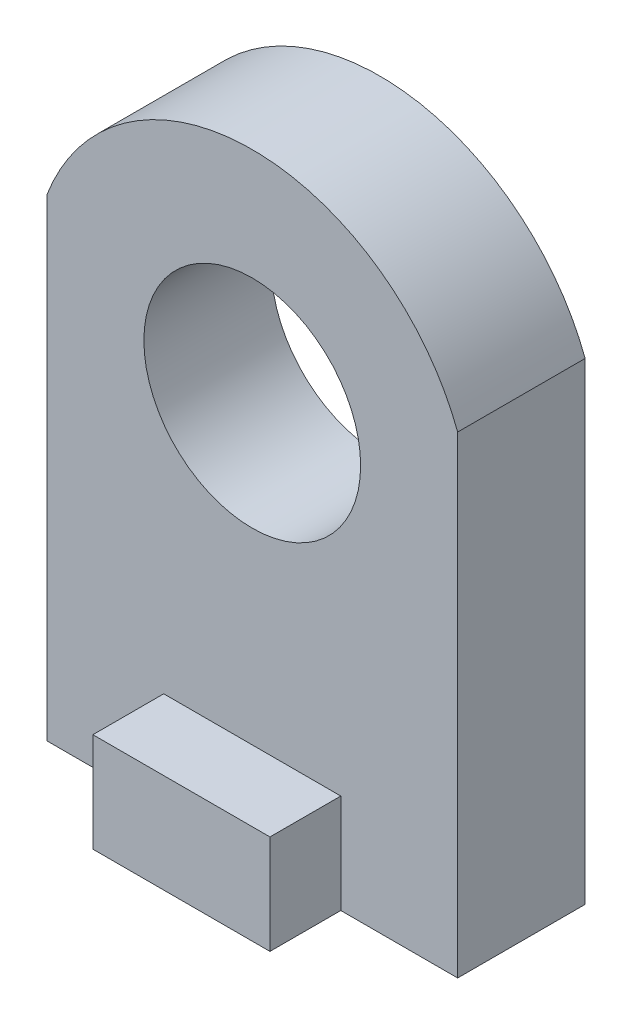
from build123d import *

# Parameters (mm, degrees)
SKETCH1_R           = 7.65
BOSS_EXTRUDE1_DEPTH = 9
SKETCH2_W           = 12.5
SKETCH2_H           = 7
BOSS_EXTRUDE2_DEPTH = 5


with BuildPart() as part:
    # Sketch1 → Boss-Extrude1 (new body)
    with BuildSketch(Plane.XY):
        with BuildLine():
            Line((-14.5, -16.688612788), (14.5, -16.688612788))
            Line((14.5, -16.688612788), (14.5, 16.688612788))
            ThreePointArc((14.5, 16.688612788), (0, 26.711387212), (-14.5, 16.688612788))
            Line((-14.5, 16.688612788), (-14.5, -16.688612788))
        make_face()
        with Locations((0, 11.211387212)):
            Circle(SKETCH1_R, mode=Mode.SUBTRACT)
    extrude(amount=BOSS_EXTRUDE1_DEPTH)

    # Sketch2 → Boss-Extrude2 (add)
    with BuildSketch(Plane.XY.offset(9)):
        with Locations((0, -13.188612788)):
            Rectangle(SKETCH2_W, SKETCH2_H)
    extrude(amount=BOSS_EXTRUDE2_DEPTH)


solid = part.part
